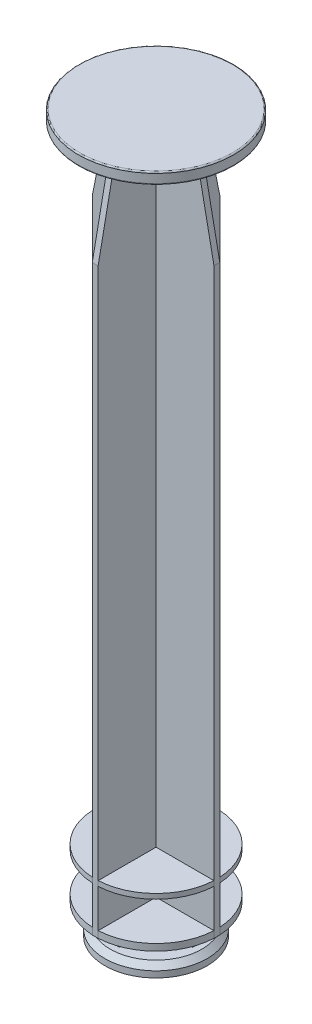
from build123d import *

# Parameters (mm, degrees)
EXTRUDE1_DEPTH    = 0.4445
CIRPATTERN1_COUNT = 2
CIRPATTERN1_ANGLE = 90
SKETCH2_W         = 7.8105
SKETCH2_H         = 1.778
SKETCH2_W_2       = 9.271
SKETCH2_H_2       = 1.016
SKETCH2_H_3       = 0.762
SKETCH2_W_3       = 11.83005
SKETCH2_H_4       = 1.7272
CHAMFER1_SIZE     = 0.8255
FILLET1_R         = 1.905
FILLET2_R         = 0.1905


with BuildPart() as part:
    # Sketch1 → Extrude1 (new, symmetric)
    with BuildSketch(Plane.XY):
        Polygon((-6.0325, 0), (6.0325, 0), (6.0325, 4.572), (9.271, 4.572), (9.271, 93.345), (6.096, 109.22), (-6.096, 109.22), (-9.271, 93.345), (-9.271, 4.572), (-6.0325, 4.572), align=None)
    extrude1 = extrude(amount=EXTRUDE1_DEPTH, both=True)

    # CirPattern1: Extrude1 ×2 about axis
    cirpattern1_axis = Axis((0, 50, 0), (0, -1, 0))
    for i in range(1, CIRPATTERN1_COUNT):
        add(extrude1.rotate(cirpattern1_axis, i * CIRPATTERN1_ANGLE / (CIRPATTERN1_COUNT - 1)))

    # Sketch2 → Revolve1 (revolve)
    with BuildSketch(Plane.XY):
        with Locations((3.90525, 0.889)):
            Rectangle(SKETCH2_W, SKETCH2_H)
        with Locations((4.6355, 5.08)):
            Rectangle(SKETCH2_W_2, SKETCH2_H_2)
        with Locations((4.6355, 11.811)):
            Rectangle(SKETCH2_W_2, SKETCH2_H_3)
        with Locations((5.915025, 108.3564)):
            Rectangle(SKETCH2_W_3, SKETCH2_H_4)
    revolve(axis=Axis((0, 0, 0), (0, 1, 0)))

    # Chamfer1
    chamfer1_edges = [part.edges().sort_by_distance(p)[0] for p in [
        (-7.8105, 1.778, 0),
    ]]
    chamfer(chamfer1_edges, length=CHAMFER1_SIZE)

    # Fillet1
    fillet1_edges = [part.edges().sort_by_distance(p)[0] for p in [
        (0, 107.4928, -6.44144),
        (-6.44144, 107.4928, 0),
        (0, 107.4928, 6.44144),
        (6.44144, 107.4928, 0),
    ]]
    fillet(fillet1_edges, radius=FILLET1_R)

    # Fillet2
    fillet2_edges = [part.edges().sort_by_distance(p)[0] for p in [
        (-11.83005, 107.4928, 0),
        (-11.83005, 109.22, 0),
    ]]
    fillet(fillet2_edges, radius=FILLET2_R)


solid = part.part
